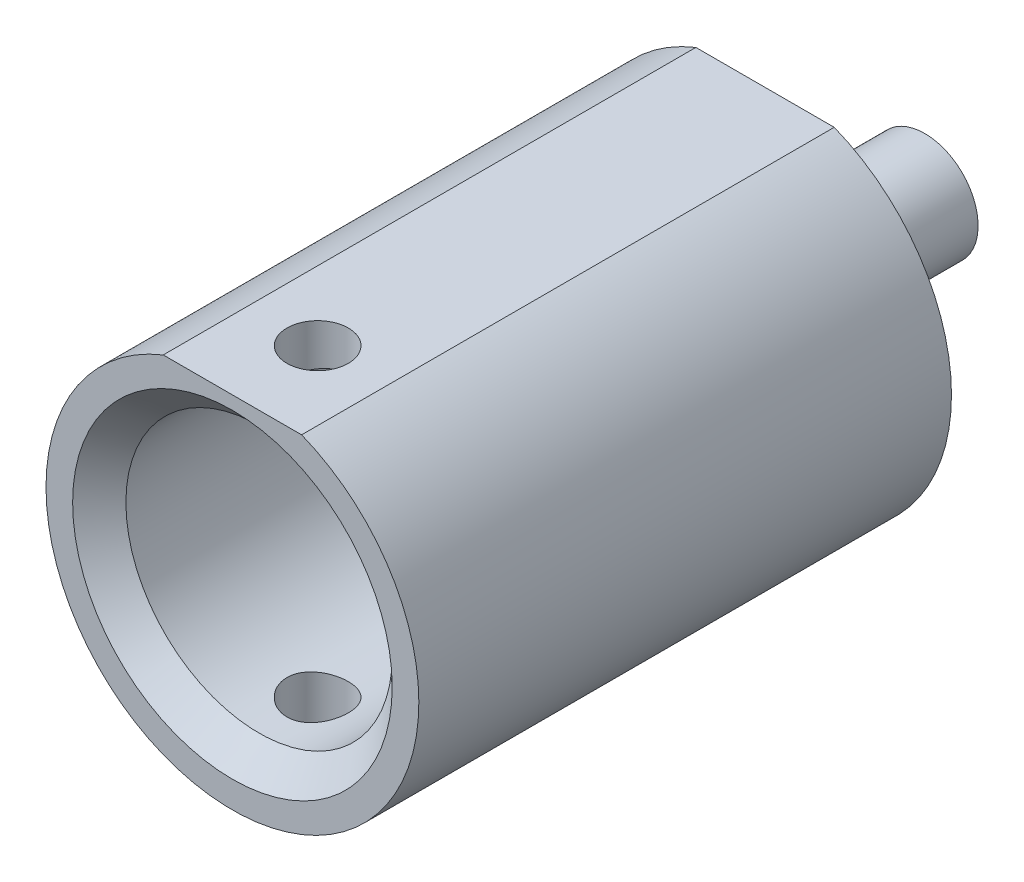
from build123d import *

# Parameters (mm, degrees)
F_5_8_0_625_DIAMETER_HOLE1_D     = 15.875
F_5_8_0_625_DIAMETER_HOLE1_DEPTH = 25.4
F_5_8_0_625_DIAMETER_HOLE1_TIP   = 4.769331164
CUT_EXTRUDE1_DEPTH               = 45.165608085
CUT_EXTRUDE1_DEPTH_BACK          = 45.165608085
SKETCH3_W                        = 31.75
SKETCH3_H                        = 0.79375
F_6_CLEARANCE_HOLE1_D            = 3.6576
CHAMFER1_SIZE                    = 1.5875


with BuildPart() as part:
    # Sketch1 → Revolve1 (revolve)
    with BuildSketch(Plane(origin=(0, 0, 0), x_dir=(1, 0, 0), z_dir=(0, 1, 0)), mode=Mode.PRIVATE) as revolve1_sk:
        Polygon((0, 0), (7.9375, 0), (11.1125, 0), (11.1125, 31.75), (3.175, 31.75), (3.175, 41.275), (0, 41.275), (0, 25.4), align=None)
    revolve(revolve1_sk.sketch.rotate(Axis((0, 0, -25.4), (0, 0, 1)), 180), axis=Axis((0, 0, -25.4), (0, 0, 1)))

    # 5/8 (0.625) Diameter Hole1
    with Locations(Plane.XY):
        with Locations((0, 0)):
            Hole(F_5_8_0_625_DIAMETER_HOLE1_D / 2, depth=F_5_8_0_625_DIAMETER_HOLE1_DEPTH)
            with Locations((0, 0, -(F_5_8_0_625_DIAMETER_HOLE1_DEPTH + F_5_8_0_625_DIAMETER_HOLE1_TIP / 2))):  # 118° drill point
                Cone(0, F_5_8_0_625_DIAMETER_HOLE1_D / 2, F_5_8_0_625_DIAMETER_HOLE1_TIP, mode=Mode.SUBTRACT)

    # Sketch3 → Cut-Extrude1 (cut, two sides: drawn at the far end of the back side and taken through both)
    with BuildSketch(Plane(origin=(0, 0, 0), x_dir=(0, 0, -1), z_dir=(1, 0, 0)).offset(-CUT_EXTRUDE1_DEPTH_BACK)):
        with Locations((15.875, 10.715625)):
            Rectangle(SKETCH3_W, SKETCH3_H)
    extrude(amount=CUT_EXTRUDE1_DEPTH + CUT_EXTRUDE1_DEPTH_BACK, mode=Mode.SUBTRACT)

    # #6 Clearance Hole1 (through all)
    with Locations(Plane(origin=(0, 10.31875, 0), x_dir=(1, 0, 0), z_dir=(0, 1, 0))):
        with Locations((0, 5.08)):
            Hole(F_6_CLEARANCE_HOLE1_D / 2)

    # Chamfer1
    chamfer1_edges = [part.edges().sort_by_distance(p)[0] for p in [
        (7.9375, 0, 0),
    ]]
    chamfer(chamfer1_edges, length=CHAMFER1_SIZE)


solid = part.part
